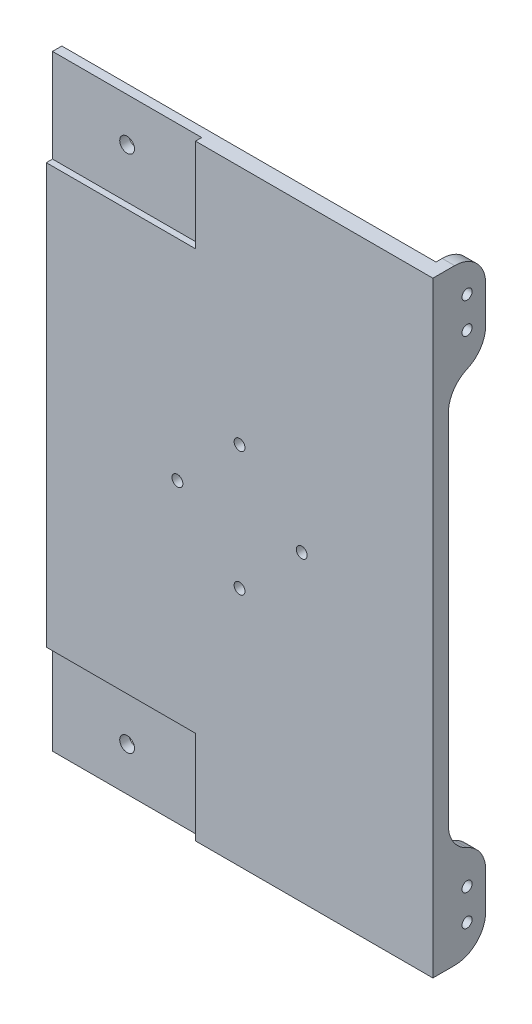
from build123d import *

# Parameters (mm, degrees)
CROQUIS1_W                  = 248.76
CROQUIS1_H                  = 195
SALIENTE_EXTRUIR1_DEPTH     = 5
CROQUIS2_W                  = 48
CROQUIS2_H                  = 30
CROQUIS2_W_2                = 30
CORTAR_EXTRUIR1_DEPTH       = 2
CROQUIS3_R                  = 2.375
CORTAR_EXTRUIR2_DEPTH       = 10
CROQUIS4_R                  = 40
SALIENTE_EXTRUIR2_DEPTH     = 206
CROQUIS5_R                  = 12.5
CORTAR_EXTRUIR3_DEPTH       = 10
CROQUIS12_W                 = 12
CROQUIS12_H                 = 30
SALIENTE_EXTRUIR3_DEPTH     = 4
REDONDEO1_R                 = 10
REDONDEO2_R                 = 10
REDONDEO3_R                 = 10
CORTAR_EXTRUIR5_DEPTH       = 262.677217236
CORTAR_EXTRUIR5_DEPTH_BACK  = 262.677217236
CROQUIS13_R                 = 1.625
CORTAR_EXTRUIR7_DEPTH       = 2
CROQUIS16_R                 = 1.75
CORTAR_EXTRUIR9_DEPTH       = 20
CROQUIS17_W                 = 120.38
CROQUIS17_H                 = 213.212791717
CORTAR_EXTRUIR10_DEPTH      = 222
CORTAR_EXTRUIR14_DEPTH      = 165.272498417
CORTAR_EXTRUIR14_DEPTH_BACK = 165.272498417
CROQUIS18_W                 = 124.38
CROQUIS18_H                 = 195


with BuildPart() as part:
    # Croquis1 → Saliente-Extruir1 (new body)
    with BuildSketch(Plane.XY):
        with Locations((7.088293187, 0.26268)):
            Rectangle(CROQUIS1_W, CROQUIS1_H)
    extrude(amount=SALIENTE_EXTRUIR1_DEPTH)

    # Croquis2 → Cortar-Extruir1 (cut)
    with BuildSketch(Plane.XY.offset(5)):
        with Locations((-93.291706813, -82.23732)):
            Rectangle(CROQUIS2_W, CROQUIS2_H)
        with Locations((116.468293187, 82.76268)):
            Rectangle(CROQUIS2_W_2, CROQUIS2_H)
        with Locations((116.468293187, -82.23732)):
            Rectangle(CROQUIS2_W_2, CROQUIS2_H)
        with Locations((-93.291706813, 82.76268)):
            Rectangle(CROQUIS2_W, CROQUIS2_H)
    extrude(amount=-CORTAR_EXTRUIR1_DEPTH, mode=Mode.SUBTRACT)

    # Croquis3 → Cortar-Extruir2 (cut)
    with BuildSketch(Plane.XY.offset(5)):
        with Locations((-93.291706813, 83.76268)):
            Circle(CROQUIS3_R)
        with Locations((-93.291706813, -83.23732)):
            Circle(CROQUIS3_R)
        with Locations((116.468293187, 83.76268)):
            Circle(CROQUIS3_R)
        with Locations((116.468293187, -83.23732)):
            Circle(CROQUIS3_R)
    extrude(amount=-CORTAR_EXTRUIR2_DEPTH, mode=Mode.SUBTRACT)

    # Croquis4 → Saliente-Extruir2 (add)
    with BuildSketch(Plane(origin=(0, 0, 0), x_dir=(-1, 0, 0), z_dir=(0, 0, -1))):
        with Locations(Location((55.101706813, 0.26268, 0), (0, 0, 180))):
            Circle(CROQUIS4_R)
    extrude(amount=SALIENTE_EXTRUIR2_DEPTH)

    # Croquis5 → Cortar-Extruir3 (cut)
    with BuildSketch(Plane(origin=(0, 0, 0), x_dir=(-1, 0, 0), z_dir=(0, 0, -1))):
        with Locations((-76.968293187, 0.26268)):
            Circle(CROQUIS5_R)
    extrude(amount=-CORTAR_EXTRUIR3_DEPTH, mode=Mode.SUBTRACT)

    # Croquis12 → Saliente-Extruir3 (add, symmetric)
    with BuildSketch(Plane(origin=(7.088293187, 0, 0), x_dir=(0, 0, -1), z_dir=(1, 0, 0))):
        with Locations((6, 82.76268)):
            Rectangle(CROQUIS12_W, CROQUIS12_H)
        with Locations((6, -82.23732)):
            Rectangle(CROQUIS12_W, CROQUIS12_H)
    extrude(amount=SALIENTE_EXTRUIR3_DEPTH, both=True)

    # Redondeo1
    redondeo1_edges = [part.edges().sort_by_distance(p)[0] for p in [
        (7.088293187, 67.76268, 0),
        (7.088293187, -67.23732, 0),
    ]]
    fillet(redondeo1_edges, radius=REDONDEO1_R)

    # Redondeo2
    redondeo2_edges = [part.edges().sort_by_distance(p)[0] for p in [
        (7.088293187, 67.76268, -12),
        (7.088293187, -67.23732, -12),
    ]]
    fillet(redondeo2_edges, radius=REDONDEO2_R)

    # Redondeo3
    redondeo3_edges = [part.edges().sort_by_distance(p)[0] for p in [
        (7.088293187, 97.76268, -12),
        (7.088293187, -97.23732, -12),
    ]]
    fillet(redondeo3_edges, radius=REDONDEO3_R)

    # Croquis13 → Cortar-Extruir5 (cut, two sides: drawn at the far end of the back side and taken through both)
    with BuildSketch(Plane(origin=(11.088293187, 0, 0), x_dir=(0, 0, -1), z_dir=(1, 0, 0)).offset(-CORTAR_EXTRUIR5_DEPTH_BACK)):
        with Locations(Location((6, 87.76268, 0), (0, 0, 90))):
            Circle(CROQUIS13_R)
        with Locations(Location((6, 77.76268, 0), (0, 0, 90))):
            Circle(CROQUIS13_R)
        with Locations(Location((6, -77.23732, 0), (0, 0, 90))):
            Circle(CROQUIS13_R)
        with Locations(Location((6, -87.23732, 0), (0, 0, 90))):
            Circle(CROQUIS13_R)
    extrude(amount=CORTAR_EXTRUIR5_DEPTH + CORTAR_EXTRUIR5_DEPTH_BACK, mode=Mode.SUBTRACT)

    # Croquis15 → Cortar-Extruir7 (cut)
    with BuildSketch(Plane.XY.offset(5)):
        Polygon((111.468293187, 67.76268), (131.468293187, 67.76268), (131.468293187, -67.23732), (111.468293187, -67.23732), (111.468293187, -59.48732), (125.218293187, -59.48732), (125.218293187, 60.01268), (111.468293187, 60.01268), align=None)
    extrude(amount=-CORTAR_EXTRUIR7_DEPTH, mode=Mode.SUBTRACT)

    # Croquis16 → Cortar-Extruir9 (cut)
    with BuildSketch(Plane.XY.offset(5)):
        with Locations((-55.101706813, 20.26268)):
            Circle(CROQUIS16_R)
        with Locations((-35.101706813, 0.26268)):
            Circle(CROQUIS16_R)
        with Locations((-55.101706813, -19.73732)):
            Circle(CROQUIS16_R)
        with Locations((-75.101706813, 0.26268)):
            Circle(CROQUIS16_R)
    extrude(amount=-CORTAR_EXTRUIR9_DEPTH, mode=Mode.SUBTRACT)

    # Croquis17 → Cortar-Extruir10 (cut)
    with BuildSketch(Plane.XZ.offset(97.23732)):
        with Locations((-57.101706813, -106.606395859)):
            Rectangle(CROQUIS17_W, CROQUIS17_H)
    extrude(amount=-CORTAR_EXTRUIR10_DEPTH, mode=Mode.SUBTRACT)

    # Croquis18 → Cortar-Extruir14 (cut, two sides: drawn at the far end of the back side and taken through both)
    with BuildSketch(Plane(origin=(0, 0, 0), x_dir=(-1, 0, 0), z_dir=(0, 0, -1)).offset(-CORTAR_EXTRUIR14_DEPTH_BACK)):
        with Locations((-69.278293187, 0.26268)):
            Rectangle(CROQUIS18_W, CROQUIS18_H)
    extrude(amount=CORTAR_EXTRUIR14_DEPTH + CORTAR_EXTRUIR14_DEPTH_BACK, mode=Mode.SUBTRACT)


solid = part.part
